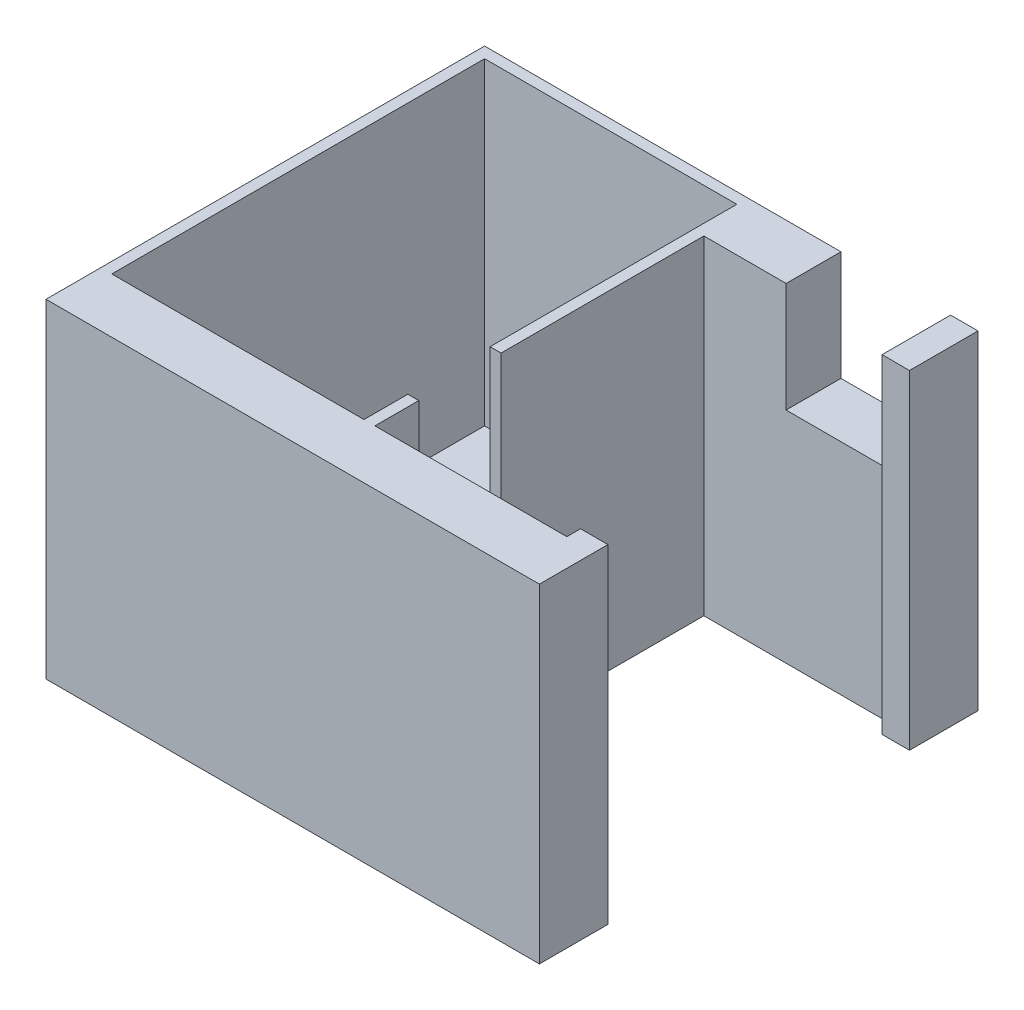
from build123d import *

# Parameters (mm, degrees)
SKETCH1_W           = 90
SKETCH1_H           = 80
SKETCH1_W_2         = 35
SKETCH1_H_2         = 60
BOSS_EXTRUDE1_DEPTH = 60
SKETCH2_W           = 46
SKETCH2_H           = 68
CUT_EXTRUDE1_DEPTH  = 58
SKETCH3_W           = 15
SKETCH3_H           = 50
CUT_EXTRUDE2_DEPTH  = 2
SKETCH4_W           = 20
SKETCH4_H           = 20
CUT_EXTRUDE3_DEPTH  = 10
SKETCH5_W           = 55
SKETCH5_H           = 60
CUT_EXTRUDE4_DEPTH  = 10


with BuildPart() as part:
    # Sketch1 → Boss-Extrude1 (new body)
    with BuildSketch(Plane(origin=(0, 0, 0), x_dir=(1, 0, 0), z_dir=(0, 1, 0))):
        with Locations((-5.196940727, -10.728489484)):
            Rectangle(SKETCH1_W, SKETCH1_H)
        with Locations((17.303059273, -10.728489484)):
            Rectangle(SKETCH1_W_2, SKETCH1_H_2, mode=Mode.SUBTRACT)
    extrude(amount=BOSS_EXTRUDE1_DEPTH)

    # Sketch2 → Cut-Extrude1 (cut)
    with BuildSketch(Plane(origin=(0, 60, 0), x_dir=(1, 0, 0), z_dir=(0, 1, 0))):
        with Locations((-25.196940727, -6.728489484)):
            Rectangle(SKETCH2_W, SKETCH2_H)
    extrude(amount=-CUT_EXTRUDE1_DEPTH, mode=Mode.SUBTRACT)

    # Sketch3 → Cut-Extrude2 (cut)
    with BuildSketch(Plane.ZY.offset(2.196940727)):
        with Locations((25.228489484, 35)):
            Rectangle(SKETCH3_W, SKETCH3_H)
    extrude(amount=-CUT_EXTRUDE2_DEPTH, mode=Mode.SUBTRACT)

    # Sketch4 → Cut-Extrude3 (cut)
    with BuildSketch(Plane(origin=(0, 0, -29.271510516), x_dir=(-1, 0, 0), z_dir=(0, 0, -1))):
        with Locations((-24.803059273, 50)):
            Rectangle(SKETCH4_W, SKETCH4_H)
    extrude(amount=-CUT_EXTRUDE3_DEPTH, mode=Mode.SUBTRACT)

    # Sketch5 → Cut-Extrude4 (cut)
    with BuildSketch(Plane(origin=(39.803059273, 0, 0), x_dir=(0, 0, -1), z_dir=(1, 0, 0))):
        with Locations((-10.728489484, 30)):
            Rectangle(SKETCH5_W, SKETCH5_H)
    extrude(amount=-CUT_EXTRUDE4_DEPTH, mode=Mode.SUBTRACT)

    # Sketch14 → CSK for M3 Flat Head Machine Screw1 (revolve, cut)
    with BuildSketch(Plane(origin=(-5.196940727, 30, -29.271510516), x_dir=(0, 1, 0), z_dir=(1, 0, 0))):
        Polygon((0, 0), (0, 3.081549114), (1.8, 2), (1.8, 1.35), (3.15, 0), align=None)
    revolve(axis=Axis((-5.196940727, 30, -35.621510516), (0, 0, 1)), mode=Mode.SUBTRACT)


solid = part.part
